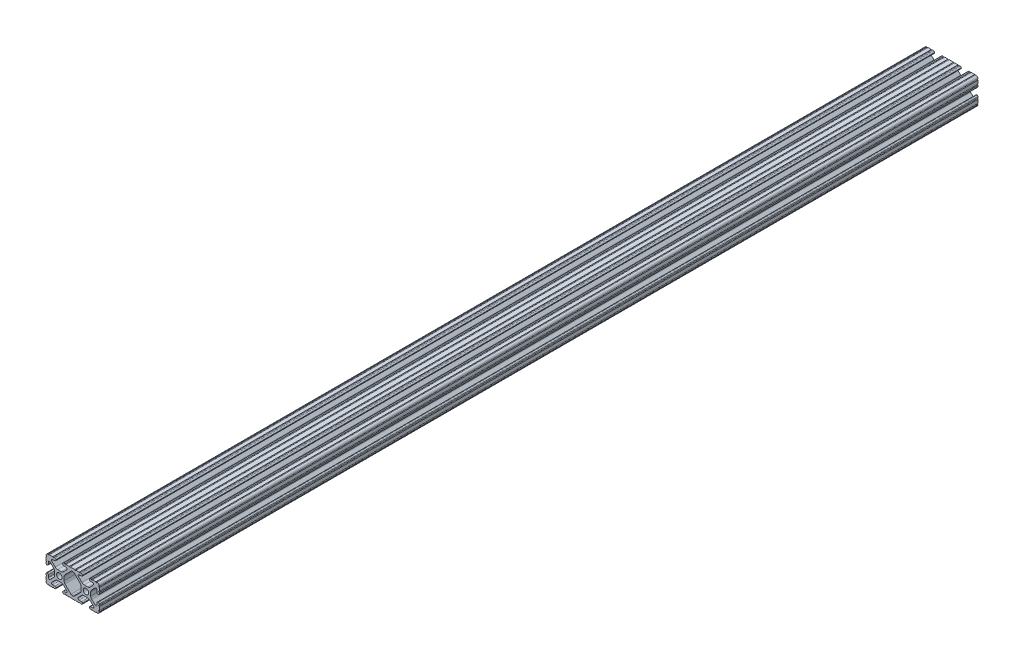
from build123d import *

# Parameters (mm, degrees)
SKETCH1_R           = 2.6035
BOSS_EXTRUDE1_DEPTH = 419.1


with BuildPart() as part:
    # Sketch1 → Boss-Extrude1 (new, symmetric)
    with BuildSketch(Plane.XY):
        with BuildLine():
            Line((18.01710265, 12.7), (16.98745015, 12.7))
            ThreePointArc((16.98745015, 12.7), (16.245730386, 12.392769614), (15.9385, 11.65104985))
            Line((15.9385, 11.65104985), (15.9385, 11.53922))
            ThreePointArc((15.9385, 11.53922), (16.245750844, 10.797450844), (16.98752, 10.4902))
            Line((16.98752, 10.4902), (19.116384363, 10.4902))
            ThreePointArc((19.116384363, 10.4902), (20.052502933, 9.869096983), (19.844087081, 8.765172272))
            Line((19.844087081, 8.765172272), (16.618993479, 5.455112286))
            ThreePointArc((16.618993479, 5.455112286), (15.578994274, 4.745442459), (14.344932584, 4.4958))
            Line((14.344932584, 4.4958), (11.083317835, 4.4958))
            ThreePointArc((11.083317835, 4.4958), (9.854330953, 4.743306833), (8.816955189, 5.447238587))
            Line((8.816955189, 5.447238587), (5.564154119, 8.762652677))
            ThreePointArc((5.564154119, 8.762652677), (5.352591412, 9.867473037), (6.289393385, 10.4902))
            Line((6.289393385, 10.4902), (8.41248, 10.4902))
            ThreePointArc((8.41248, 10.4902), (9.154249156, 10.797450844), (9.4615, 11.53922))
            Line((9.4615, 11.53922), (9.4615, 11.65104985))
            ThreePointArc((9.4615, 11.65104985), (9.154269614, 12.392769614), (8.41254985, 12.7))
            Line((8.41254985, 12.7), (7.38288465, 12.7))
            ThreePointArc((7.38288465, 12.7), (6.87488465, 12.192), (6.36688465, 12.7))
            Line((6.36688465, 12.7), (3.14958095, 12.7))
            ThreePointArc((3.14958095, 12.7), (2.64158095, 12.192), (2.13358095, 12.7))
            Line((2.13358095, 12.7), (-2.13358095, 12.7))
            ThreePointArc((-2.13358095, 12.7), (-2.64158095, 12.192), (-3.14958095, 12.7))
            Line((-3.14958095, 12.7), (-6.36689735, 12.7))
            ThreePointArc((-6.36689735, 12.7), (-6.87489735, 12.192), (-7.38289735, 12.7))
            Line((-7.38289735, 12.7), (-8.41254985, 12.7))
            ThreePointArc((-8.41254985, 12.7), (-9.154269614, 12.392769614), (-9.4615, 11.65104985))
            Line((-9.4615, 11.65104985), (-9.4615, 11.53922))
            ThreePointArc((-9.4615, 11.53922), (-9.154249156, 10.797450844), (-8.41248, 10.4902))
            Line((-8.41248, 10.4902), (-6.283641037, 10.4902))
            ThreePointArc((-6.283641037, 10.4902), (-5.297291557, 9.829633109), (-5.532576693, 8.666071843))
            Line((-5.532576693, 8.666071843), (-8.809985098, 5.416263103))
            ThreePointArc((-8.809985098, 5.416263103), (-9.836720513, 4.734920264), (-11.045536121, 4.4958))
            Line((-11.045536121, 4.4958), (-14.354463879, 4.4958))
            ThreePointArc((-14.354463879, 4.4958), (-15.563279487, 4.734920264), (-16.590014902, 5.416263103))
            Line((-16.590014902, 5.416263103), (-19.867423307, 8.666071843))
            ThreePointArc((-19.867423307, 8.666071843), (-20.102708443, 9.829633109), (-19.116358963, 10.4902))
            Line((-19.116358963, 10.4902), (-16.98752, 10.4902))
            ThreePointArc((-16.98752, 10.4902), (-16.245750844, 10.797450844), (-15.9385, 11.53922))
            Line((-15.9385, 11.53922), (-15.9385, 11.65104985))
            ThreePointArc((-15.9385, 11.65104985), (-16.245730386, 12.392769614), (-16.98745015, 12.7))
            Line((-16.98745015, 12.7), (-18.01711535, 12.7))
            ThreePointArc((-18.01711535, 12.7), (-18.52511535, 12.192), (-19.03311535, 12.7))
            Line((-19.03311535, 12.7), (-22.2504, 12.7))
            ThreePointArc((-22.2504, 12.7), (-22.758323491, 12.192000006), (-23.266399977, 12.699846982))
            ThreePointArc((-23.266399977, 12.699846982), (-24.782522516, 12.082522516), (-25.399846982, 10.566399977))
            ThreePointArc((-25.399846982, 10.566399977), (-24.892000006, 10.058323491), (-25.4, 9.5504))
            Line((-25.4, 9.5504), (-25.4, 6.3330836))
            ThreePointArc((-25.4, 6.3330836), (-24.892, 5.8250836), (-25.4, 5.3170836))
            Line((-25.4, 5.3170836), (-25.4, 4.237520184))
            ThreePointArc((-25.4, 4.237520184), (-25.107393763, 3.531106237), (-24.400979816, 3.2385))
            Line((-24.400979816, 3.2385), (-24.23922, 3.2385))
            ThreePointArc((-24.23922, 3.2385), (-23.497450844, 3.545750844), (-23.1902, 4.28752))
            Line((-23.1902, 4.28752), (-23.1902, 6.334741132))
            ThreePointArc((-23.1902, 6.334741132), (-22.556026952, 7.286023527), (-21.434002553, 7.066535717))
            Line((-21.434002553, 7.066535717), (-18.147950853, 3.808156468))
            ThreePointArc((-18.147950853, 3.808156468), (-17.452759693, 2.774838327), (-17.208501877, 1.553619571))
            Line((-17.208501877, 1.553619571), (-17.208501877, -1.695179196))
            ThreePointArc((-17.208501877, -1.695179196), (-17.450738657, -2.911536421), (-18.140486065, -3.942289578))
            Line((-18.140486065, -3.942289578), (-21.431579576, -7.227386226))
            ThreePointArc((-21.431579576, -7.227386226), (-22.55444896, -7.449940594), (-23.1902, -6.498002195))
            Line((-23.1902, -6.498002195), (-23.1902, -4.28752))
            ThreePointArc((-23.1902, -4.28752), (-23.497450844, -3.545750844), (-24.23922, -3.2385))
            Line((-24.23922, -3.2385), (-24.35098, -3.2385))
            ThreePointArc((-24.35098, -3.2385), (-25.092749156, -3.545750844), (-25.4, -4.28752))
            Line((-25.4, -4.28752), (-25.4, -5.3171344))
            ThreePointArc((-25.4, -5.3171344), (-24.892, -5.8251344), (-25.4, -6.3331344))
            Line((-25.4, -6.3331344), (-25.4, -9.5504))
            ThreePointArc((-25.4, -9.5504), (-24.892000006, -10.058323491), (-25.399846982, -10.566399977))
            ThreePointArc((-25.399846982, -10.566399977), (-24.782522516, -12.082522516), (-23.266399977, -12.699846982))
            ThreePointArc((-23.266399977, -12.699846982), (-22.758323491, -12.192000006), (-22.2504, -12.7))
            Line((-22.2504, -12.7), (-19.03308995, -12.7))
            ThreePointArc((-19.03308995, -12.7), (-18.52508995, -12.192), (-18.01708995, -12.7))
            Line((-18.01708995, -12.7), (-16.9874692, -12.7))
            ThreePointArc((-16.9874692, -12.7), (-16.245700044, -12.392749156), (-15.9384492, -11.65098))
            Line((-15.9384492, -11.65098), (-15.9384492, -11.53922))
            ThreePointArc((-15.9384492, -11.53922), (-16.245700044, -10.797450844), (-16.9874692, -10.4902))
            Line((-16.9874692, -10.4902), (-19.116358963, -10.4902))
            ThreePointArc((-19.116358963, -10.4902), (-20.055197748, -9.862578342), (-19.834124023, -8.755124678))
            Line((-19.834124023, -8.755124678), (-16.49660751, -5.423689618))
            ThreePointArc((-16.49660751, -5.423689618), (-15.467274017, -4.736928798), (-14.253591699, -4.4958))
            Line((-14.253591699, -4.4958), (-11.146408301, -4.4958))
            ThreePointArc((-11.146408301, -4.4958), (-9.932725983, -4.736928798), (-8.90339249, -5.423689618))
            Line((-8.90339249, -5.423689618), (-5.565875977, -8.755124678))
            ThreePointArc((-5.565875977, -8.755124678), (-5.344802252, -9.862578342), (-6.283641037, -10.4902))
            Line((-6.283641037, -10.4902), (-8.4125308, -10.4902))
            ThreePointArc((-8.4125308, -10.4902), (-9.154299956, -10.797450844), (-9.4615508, -11.53922))
            Line((-9.4615508, -11.53922), (-9.4615508, -11.65098))
            ThreePointArc((-9.4615508, -11.65098), (-9.154299956, -12.392749156), (-8.4125308, -12.7))
            Line((-8.4125308, -12.7), (-7.38287195, -12.7))
            ThreePointArc((-7.38287195, -12.7), (-6.87487195, -12.192), (-6.36687195, -12.7))
            Line((-6.36687195, -12.7), (-3.14960635, -12.7))
            ThreePointArc((-3.14960635, -12.7), (-2.64160635, -12.192), (-2.13360635, -12.7))
            Line((-2.13360635, -12.7), (2.13360635, -12.7))
            ThreePointArc((2.13360635, -12.7), (2.64159365, -12.1920127), (3.14958095, -12.7))
            Line((3.14958095, -12.7), (6.36691005, -12.7))
            ThreePointArc((6.36691005, -12.7), (6.87491005, -12.192), (7.38291005, -12.7))
            Line((7.38291005, -12.7), (8.4125308, -12.7))
            ThreePointArc((8.4125308, -12.7), (9.154299956, -12.392749156), (9.4615508, -11.65098))
            Line((9.4615508, -11.65098), (9.4615508, -11.53922))
            ThreePointArc((9.4615508, -11.53922), (9.154299956, -10.797450844), (8.4125308, -10.4902))
            Line((8.4125308, -10.4902), (6.289393385, -10.4902))
            ThreePointArc((6.289393385, -10.4902), (5.231590322, -9.783049717), (5.480677245, -8.535265862))
            Line((5.480677245, -8.535265862), (8.597933595, -5.423689618))
            ThreePointArc((8.597933595, -5.423689618), (9.627267088, -4.736928798), (10.840949406, -4.4958))
            Line((10.840949406, -4.4958), (14.102564155, -4.4958))
            ThreePointArc((14.102564155, -4.4958), (15.215927525, -4.697410182), (16.187895372, -5.276636531))
            Line((16.187895372, -5.276636531), (19.868247549, -8.482246082))
            ThreePointArc((19.868247549, -8.482246082), (20.188435806, -9.746879864), (19.116384363, -10.4902))
            Line((19.116384363, -10.4902), (16.9874692, -10.4902))
            ThreePointArc((16.9874692, -10.4902), (16.245700044, -10.797450844), (15.9384492, -11.53922))
            Line((15.9384492, -11.53922), (15.9384492, -11.65098))
            ThreePointArc((15.9384492, -11.65098), (16.245700044, -12.392749156), (16.9874692, -12.7))
            Line((16.9874692, -12.7), (18.01710265, -12.7))
            ThreePointArc((18.01710265, -12.7), (18.52510265, -12.192), (19.03310265, -12.7))
            Line((19.03310265, -12.7), (22.2504, -12.7))
            ThreePointArc((22.2504, -12.7), (22.758323491, -12.192000006), (23.266399977, -12.699846982))
            ThreePointArc((23.266399977, -12.699846982), (24.782522516, -12.082522516), (25.399846982, -10.566399977))
            ThreePointArc((25.399846982, -10.566399977), (24.892000006, -10.058323492), (25.4, -9.550400001))
            Line((25.4, -9.550400001), (25.4, -6.333083592))
            ThreePointArc((25.4, -6.333083592), (24.892000001, -5.825083593), (25.4, -5.317083593))
            Line((25.4, -5.317083593), (25.4, -4.237520184))
            ThreePointArc((25.4, -4.237520184), (25.107393763, -3.531106237), (24.400979816, -3.2385))
            Line((24.400979816, -3.2385), (24.189220184, -3.2385))
            ThreePointArc((24.189220184, -3.2385), (23.482806237, -3.531106237), (23.1902, -4.237520184))
            Line((23.1902, -4.237520184), (23.1902, -6.155876159))
            ThreePointArc((23.1902, -6.155876159), (22.62232736, -7.038258539), (21.583974541, -6.886926384))
            Line((21.583974541, -6.886926384), (18.29817066, -4.024970844))
            ThreePointArc((18.29817066, -4.024970844), (17.493730985, -2.946044689), (17.208501877, -1.630807374))
            Line((17.208501877, -1.630807374), (17.208501877, 1.630807374))
            ThreePointArc((17.208501877, 1.630807374), (17.442348332, 2.82673414), (18.109440981, 3.846495088))
            Line((18.109440981, 3.846495088), (21.526346532, 7.353420386))
            ThreePointArc((21.526346532, 7.353420386), (22.585896263, 7.574939077), (23.1902, 6.676867167))
            Line((23.1902, 6.676867167), (23.1902, 4.237520184))
            ThreePointArc((23.1902, 4.237520184), (23.482806237, 3.531106237), (24.189220184, 3.2385))
            Line((24.189220184, 3.2385), (24.400979816, 3.2385))
            ThreePointArc((24.400979816, 3.2385), (25.107393763, 3.531106237), (25.4, 4.237520184))
            Line((25.4, 4.237520184), (25.4, 5.3170836))
            ThreePointArc((25.4, 5.3170836), (24.891949193, 5.825134407), (25.4, 6.333185215))
            Line((25.4, 6.333185215), (25.4, 9.550400015))
            ThreePointArc((25.4, 9.550400015), (24.892000013, 10.058323498), (25.399846982, 10.566399977))
            ThreePointArc((25.399846982, 10.566399977), (24.782522516, 12.082522516), (23.266399977, 12.699846982))
            ThreePointArc((23.266399977, 12.699846982), (22.758323491, 12.192000006), (22.2504, 12.7))
            Line((22.2504, 12.7), (19.03310265, 12.7))
            ThreePointArc((19.03310265, 12.7), (18.52510265, 12.192), (18.01710265, 12.7))
        make_face()
        with Locations((-12.7, 0)):
            Circle(SKETCH1_R, mode=Mode.SUBTRACT)
        with Locations((12.7, 0)):
            Circle(SKETCH1_R, mode=Mode.SUBTRACT)
        with BuildLine():
            Line((-7.259513935, -3.869413038), (-1.545748891, -9.572766749))
            ThreePointArc((-1.545748891, -9.572766749), (-1.035199478, -9.913400116), (-0.433213048, -10.033))
            Line((-0.433213048, -10.033), (0.433213048, -10.033))
            ThreePointArc((0.433213048, -10.033), (1.035199478, -9.913400116), (1.545748891, -9.572766749))
            Line((1.545748891, -9.572766749), (7.259513935, -3.869413038))
            ThreePointArc((7.259513935, -3.869413038), (7.949261343, -2.838659881), (8.191498123, -1.622302656))
            Line((8.191498123, -1.622302656), (8.191498123, 1.622302656))
            ThreePointArc((8.191498123, 1.622302656), (7.955573352, 2.823327967), (7.282860769, 3.845864069))
            Line((7.282860769, 3.845864069), (1.675572808, 9.561086461))
            ThreePointArc((1.675572808, 9.561086461), (1.161034429, 9.910236611), (0.551456936, 10.033))
            Line((0.551456936, 10.033), (-0.395199982, 10.033))
            ThreePointArc((-0.395199982, 10.033), (-0.994772524, 9.914396349), (-1.50403329, 9.576450301))
            Line((-1.50403329, 9.576450301), (-7.252049147, 3.876839553))
            ThreePointArc((-7.252049147, 3.876839553), (-7.947240307, 2.843521412), (-8.191498123, 1.622302656))
            Line((-8.191498123, 1.622302656), (-8.191498123, -1.622302656))
            ThreePointArc((-8.191498123, -1.622302656), (-7.949261343, -2.838659881), (-7.259513935, -3.869413038))
        make_face(mode=Mode.SUBTRACT)
    extrude(amount=BOSS_EXTRUDE1_DEPTH, both=True)


solid = part.part
